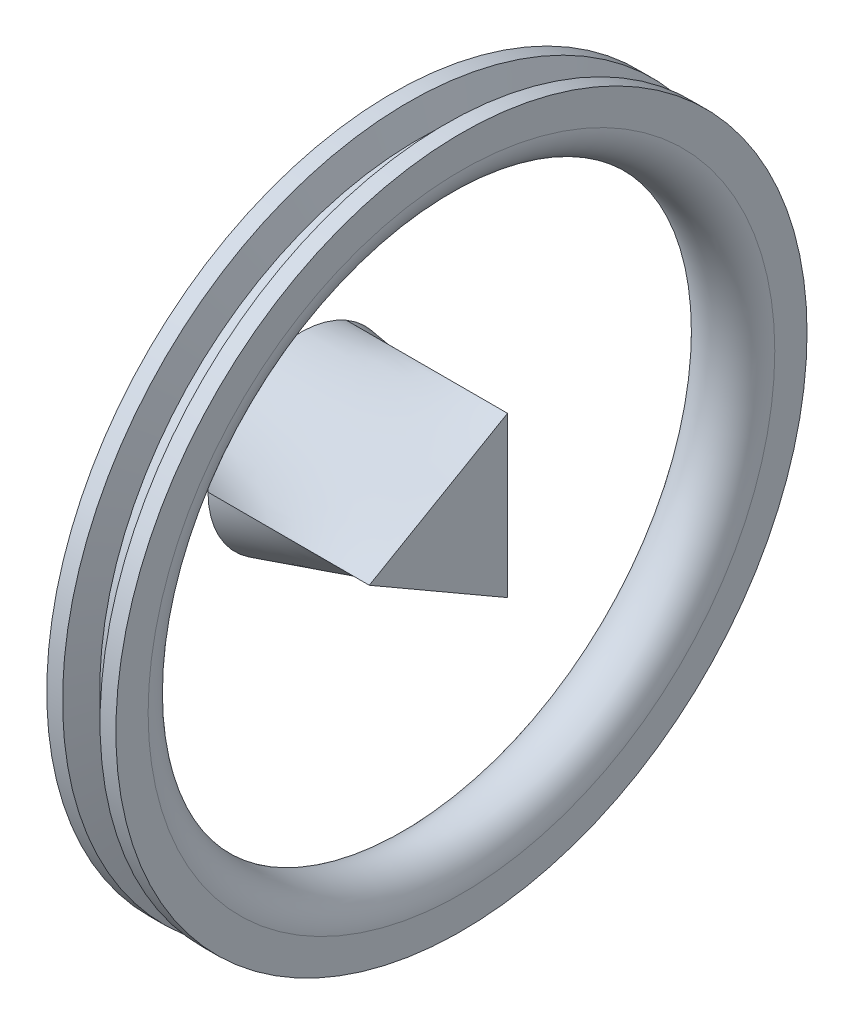
from build123d import *


with BuildPart() as part:
    # Sketch3 for Loft1 → Loft1 section 0
    with BuildSketch(Plane(origin=(0, 0, 0), x_dir=(0, 0, -1), z_dir=(1, 0, 0))):
        with BuildLine():
            # circular arc as an exact rational Bezier (weights 1, cos(half-angle), 1)
            Bezier((-20, 0), (-20.000000001, -34.641016152), (10, -17.320508076), weights=[1, 0.5, 1])
            Bezier((10, -17.320508076), (39.999999999, 0), (10, 17.320508076), weights=[1, 0.5, 1])
            Bezier((10, 17.320508076), (-20.000000001, 34.641016152), (-20, 0), weights=[1, 0.5, 1])
        make_face()
    # Sketch4 → Loft1 section 1
    with BuildSketch(Plane(origin=(35, 0, 0), x_dir=(0, 0, -1), z_dir=(1, 0, 0))):
        with BuildLine():
            Line((-20, 0), (10, -17.320508076))
            Line((10, -17.320508076), (10, 17.320508076))
            Line((10, 17.320508076), (-20, 0))
        make_face()
    loft()


with BuildPart() as body_2:
    # Sketch6 → Revolve1 (revolve)
    with BuildSketch(Plane(origin=(0, 0, 0), x_dir=(1, 0, 0), z_dir=(0, 1, 0)), mode=Mode.PRIVATE) as revolve1_sk:
        with BuildLine():
            Line((23.43403432, -75), (25.5, -69))
            Line((25.5, -69), (29.5, -69))
            Line((29.5, -69), (31.56596568, -75))
            Line((31.56596568, -75), (35, -75))
            Line((35, -75), (35, -68))
            ThreePointArc((35, -68), (27.5, -60.5), (20, -68))
            Line((20, -68), (20, -75))
            Line((20, -75), (23.43403432, -75))
        make_face()
    revolve(revolve1_sk.sketch.rotate(Axis((47.894182532, 0, 0), (-1, 0, 0)), 180), axis=Axis((47.894182532, 0, 0), (-1, 0, 0)))


solid = Compound([part.part, body_2.part])
